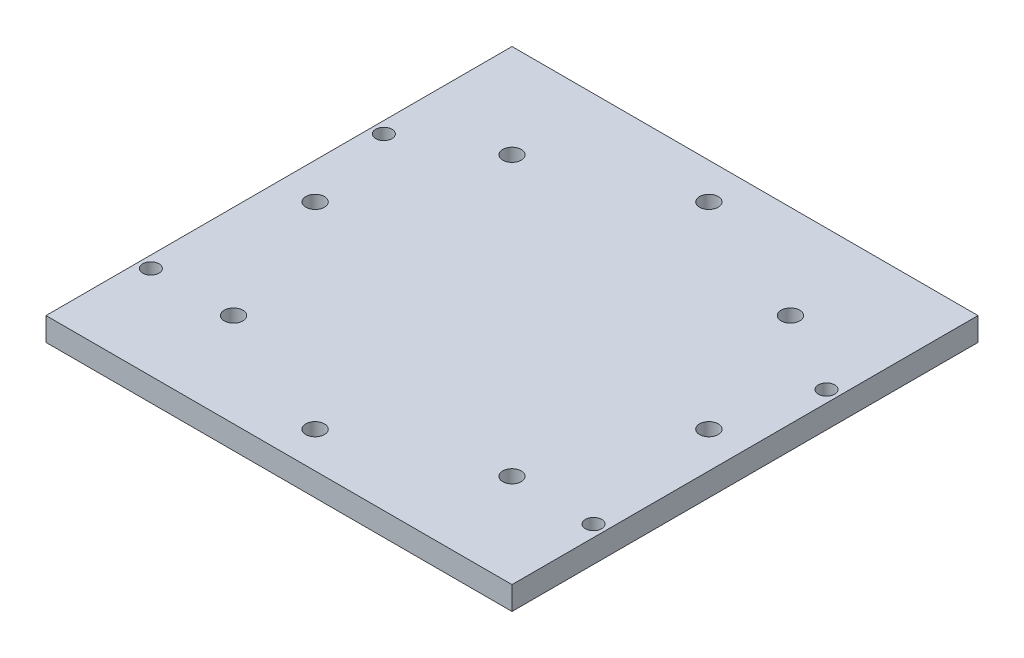
from build123d import *

# Parameters (mm, degrees)
SKETCH2_W           = 100
SKETCH2_H           = 100
SKETCH2_R           = 2
SKETCH2_R_2         = 1.75
BOSS_EXTRUDE1_DEPTH = 5


with BuildPart() as part:
    # Sketch2 → Boss-Extrude1 (new body)
    with BuildSketch(Plane(origin=(0, 0, 0), x_dir=(1, 0, 0), z_dir=(0, 1, 0))):
        with Locations((50, 50)):
            Rectangle(SKETCH2_W, SKETCH2_H)
        with Locations(Location((50, 92.25, 0), (0, 0, 270))):
            Circle(SKETCH2_R, mode=Mode.SUBTRACT)
        with Locations(Location((79.875261505, 79.875261505, 0), (0, 0, 270))):
            Circle(SKETCH2_R, mode=Mode.SUBTRACT)
        with Locations(Location((92.25, 50, 0), (0, 0, 270))):
            Circle(SKETCH2_R, mode=Mode.SUBTRACT)
        with Locations(Location((79.875261505, 20.124738495, 0), (0, 0, 270))):
            Circle(SKETCH2_R, mode=Mode.SUBTRACT)
        with Locations(Location((50, 7.75, 0), (0, 0, 270))):
            Circle(SKETCH2_R, mode=Mode.SUBTRACT)
        with Locations(Location((20.124738495, 20.124738495, 0), (0, 0, 270))):
            Circle(SKETCH2_R, mode=Mode.SUBTRACT)
        with Locations(Location((7.75, 50, 0), (0, 0, 270))):
            Circle(SKETCH2_R, mode=Mode.SUBTRACT)
        with Locations(Location((20.124738495, 79.875261505, 0), (0, 0, 270))):
            Circle(SKETCH2_R, mode=Mode.SUBTRACT)
        with Locations(Location((2.5, 20, 0), (0, 0, 270))):
            Circle(SKETCH2_R_2, mode=Mode.SUBTRACT)
        with Locations(Location((2.5, 70, 0), (0, 0, 90))):
            Circle(SKETCH2_R_2, mode=Mode.SUBTRACT)
        with Locations(Location((97.5, 20, 0), (0, 0, 90))):
            Circle(SKETCH2_R_2, mode=Mode.SUBTRACT)
        with Locations(Location((97.5, 70, 0), (0, 0, 270))):
            Circle(SKETCH2_R_2, mode=Mode.SUBTRACT)
    extrude(amount=BOSS_EXTRUDE1_DEPTH)


solid = part.part
